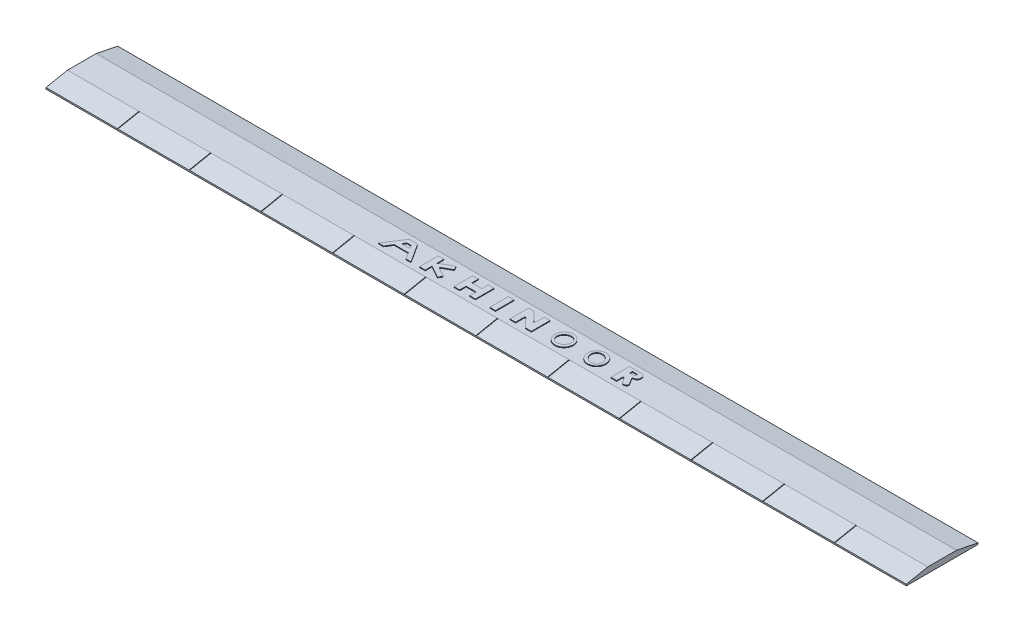
from build123d import *

# Parameters (mm, degrees)
SKETCH1_W           = 304.8
SKETCH1_H           = 25.4
BOSS_EXTRUDE1_DEPTH = 2.032
SKETCH2_OUTSIDE_W   = 88.572
SKETCH2_OUTSIDE_H   = 65.204
CUT_EXTRUDE2_DEPTH  = 306.863252163
SKETCH4_W           = 2.032
SKETCH4_H           = 6.604
SKETCH4_W_2         = 3.556
SKETCH4_H_2         = 2.032
SKETCH4_RX          = 3.302
SKETCH4_RY          = 3.236880332
SKETCH4_RX_2        = 2.468882323
SKETCH4_RY_2        = 2.157115795
BOSS_EXTRUDE2_DEPTH = 0.254
SKETCH5_W           = 0.254
SKETCH5_H           = 7.770905738
CUT_EXTRUDE9_DEPTH  = 0.1778


with BuildPart() as part:
    # Sketch1 → Boss-Extrude1 (new body)
    with BuildSketch(Plane(origin=(0, 0, 0), x_dir=(1, 0, 0), z_dir=(0, 1, 0))):
        with Locations((-152.4, 12.7)):
            Rectangle(SKETCH1_W, SKETCH1_H)
    extrude(amount=BOSS_EXTRUDE1_DEPTH)

    # Sketch2 outside → Cut-Extrude2 (cut, through all)
    with BuildSketch(Plane(origin=(0, 0, 0), x_dir=(0, 0, -1), z_dir=(1, 0, 0))):
        with Locations((12.7, 1.016)):
            Rectangle(SKETCH2_OUTSIDE_W, SKETCH2_OUTSIDE_H)
        Polygon((0, 0.508), (7.62, 2.032), (12.7, 2.032), (17.78, 2.032), (25.4, 0.508), (25.4, 0), (0, 0), align=None, mode=Mode.SUBTRACT)
    extrude(amount=-CUT_EXTRUDE2_DEPTH, mode=Mode.SUBTRACT)

    # Sketch4 → Boss-Extrude2 (add)
    # profile 1 of 11: a face of its own
    with BuildSketch(Plane(origin=(0, 2.032, 0), x_dir=(1, 0, 0), z_dir=(0, 1, 0))):
        with Locations((-180.848, 12.7)):
            Rectangle(SKETCH4_W, SKETCH4_H)
    # profile 2 of 11: a face of its own
    with BuildSketch(Plane(origin=(0, 2.032, 0), x_dir=(1, 0, 0), z_dir=(0, 1, 0))):
        with BuildLine():
            ThreePointArc((-179.701441188, 13.661600321), (-179.796940702, 13.568380332), (-179.832, 13.43961322))
            Line((-179.832, 13.43961322), (-179.832, 12.7))
            Line((-179.832, 12.7), (-179.832, 11.96038678))
            ThreePointArc((-179.832, 11.96038678), (-179.796940702, 11.831619668), (-179.701441188, 11.738399679))
            Line((-179.701441188, 11.738399679), (-175.49264713, 9.398))
            Line((-175.49264713, 9.398), (-174.875441188, 10.507935505))
            ThreePointArc((-174.875441188, 10.507935505), (-174.853173604, 10.701059177), (-174.973987101, 10.853363795))
            Line((-174.973987101, 10.853363795), (-177.895630596, 12.478012899))
            ThreePointArc((-177.895630596, 12.478012899), (-178.026189408, 12.7), (-177.895630596, 12.921987101))
            Line((-177.895630596, 12.921987101), (-174.973987101, 14.546636205))
            ThreePointArc((-174.973987101, 14.546636205), (-174.853173604, 14.698940823), (-174.875441188, 14.892064495))
            Line((-174.875441188, 14.892064495), (-175.49264713, 16.002))
            Line((-175.49264713, 16.002), (-179.701441188, 13.661600321))
        make_face()
    # profile 3 of 11: a face of its own
    with BuildSketch(Plane(origin=(0, 2.032, 0), x_dir=(1, 0, 0), z_dir=(0, 1, 0))):
        Polygon((-167.64, 11.684), (-167.64, 13.716), (-167.64, 16.002), (-169.672, 16.002), (-169.672, 9.398), (-167.64, 9.398), align=None)
    # profile 4 of 11: a face of its own
    with BuildSketch(Plane(origin=(0, 2.032, 0), x_dir=(1, 0, 0), z_dir=(0, 1, 0))):
        with Locations((-163.068, 12.7)):
            Rectangle(SKETCH4_W, SKETCH4_H)
    # profile 5 of 11: a face of its own
    with BuildSketch(Plane(origin=(0, 2.032, 0), x_dir=(1, 0, 0), z_dir=(0, 1, 0))):
        with Locations((-165.862, 12.7)):
            Rectangle(SKETCH4_W_2, SKETCH4_H_2)
    # profile 6 of 11: a face of its own
    with BuildSketch(Plane(origin=(0, 2.032, 0), x_dir=(1, 0, 0), z_dir=(0, 1, 0))):
        with Locations((-155.956, 12.7)):
            Rectangle(SKETCH4_W, SKETCH4_H)
    # profile 7 of 11: a face of its own
    with BuildSketch(Plane(origin=(0, 2.032, 0), x_dir=(1, 0, 0), z_dir=(0, 1, 0))):
        with BuildLine():
            ThreePointArc((-144.710582264, 12.704200751), (-144.432106164, 12.642678456), (-144.272, 12.878686819))
            Line((-144.272, 12.878686819), (-144.272, 16.002))
            Line((-144.272, 16.002), (-142.24, 16.002))
            Line((-142.24, 16.002), (-142.24, 9.398))
            Line((-142.24, 9.398), (-144.272, 9.398))
            ThreePointArc((-144.272, 9.398), (-144.372490146, 9.418723918), (-144.456582264, 9.477513932))
            Line((-144.456582264, 9.477513932), (-147.389417736, 12.58005053))
            ThreePointArc((-147.389417736, 12.58005053), (-147.667893836, 12.641572825), (-147.828, 12.405564462))
            Line((-147.828, 12.405564462), (-147.828, 9.398))
            Line((-147.828, 9.398), (-149.86, 9.398))
            Line((-149.86, 9.398), (-149.86, 16.002))
            Line((-149.86, 16.002), (-147.828, 16.002))
            Line((-147.828, 16.002), (-144.710582264, 12.704200751))
        make_face()
    # profile 8 of 11: a face of its own
    with BuildSketch(Plane(origin=(0, 2.032, 0), x_dir=(1, 0, 0), z_dir=(0, 1, 0))):
        with Locations(Location((-133.923119668, 12.7), (0, 0, -90))):
            Ellipse(SKETCH4_RX, SKETCH4_RY)
        with Locations(Location((-133.923119668, 12.7), (0, 0, 39.538825136))):
            Ellipse(SKETCH4_RX_2, SKETCH4_RY_2, mode=Mode.SUBTRACT)
    # profile 9 of 11: a face of its own
    with BuildSketch(Plane(origin=(0, 2.032, 0), x_dir=(1, 0, 0), z_dir=(0, 1, 0))):
        with Locations(Location((-122.369359004, 12.7), (0, 0, -90))):
            Ellipse(SKETCH4_RX, SKETCH4_RY)
        with Locations(Location((-122.369359004, 12.7), (0, 0, 140.461174864))):
            Ellipse(SKETCH4_RX_2, SKETCH4_RY_2, mode=Mode.SUBTRACT)
    # profile 10 of 11: a face of its own
    with BuildSketch(Plane(origin=(0, 2.032, 0), x_dir=(1, 0, 0), z_dir=(0, 1, 0))):
        with BuildLine():
            Line((-111.560968993, 11.504926098), (-110.164699128, 9.582601219))
            ThreePointArc((-110.164699128, 9.582601219), (-109.140807711, 9.563074793), (-108.572707527, 10.415129425))
            Line((-108.572707527, 10.415129425), (-110.003457223, 12.733919497))
            ThreePointArc((-110.003457223, 12.733919497), (-110.009098265, 12.991067287), (-109.787294363, 13.121297223))
            Line((-109.787294363, 13.121297223), (-109.734478672, 13.121297223))
            ThreePointArc((-109.734478672, 13.121297223), (-108.83645306, 13.493271611), (-108.464478672, 14.391297223))
            Line((-108.464478672, 14.391297223), (-108.464478672, 14.732))
            ThreePointArc((-108.464478672, 14.732), (-108.83645306, 15.630025612), (-109.734478672, 16.002))
            Line((-109.734478672, 16.002), (-111.135692822, 16.002))
            Line((-111.135692822, 16.002), (-114.052478672, 16.002))
            Line((-114.052478672, 16.002), (-114.052478672, 9.398))
            Line((-114.052478672, 9.398), (-112.020478672, 9.398))
            Line((-112.020478672, 9.398), (-112.020478672, 11.355655298))
            ThreePointArc((-112.020478672, 11.355655298), (-111.844953323, 11.597228743), (-111.560968993, 11.504926098))
        make_face()
        with BuildLine():
            Line((-110.242478672, 14.224), (-110.242478672, 14.732))
            ThreePointArc((-110.242478672, 14.732), (-110.31687355, 14.911605122), (-110.496478672, 14.986))
            Line((-110.496478672, 14.986), (-111.766478672, 14.986))
            ThreePointArc((-111.766478672, 14.986), (-111.946083795, 14.911605122), (-112.020478672, 14.732))
            Line((-112.020478672, 14.732), (-112.020478672, 14.224))
            ThreePointArc((-112.020478672, 14.224), (-111.946083795, 14.044394878), (-111.766478672, 13.97))
            Line((-111.766478672, 13.97), (-110.496478672, 13.97))
            ThreePointArc((-110.496478672, 13.97), (-110.31687355, 14.044394878), (-110.242478672, 14.224))
        make_face(mode=Mode.SUBTRACT)
    # profile 11 of 11: a face of its own
    with BuildSketch(Plane(origin=(0, 2.032, 0), x_dir=(1, 0, 0), z_dir=(0, 1, 0))):
        with BuildLine():
            ThreePointArc((-188.050459309, 11.607699185), (-188.142583121, 11.694367018), (-188.265083498, 11.725859361))
            Line((-188.265083498, 11.725859361), (-192.993173567, 11.725859361))
            ThreePointArc((-192.993173567, 11.725859361), (-193.115673944, 11.694367018), (-193.207797756, 11.607699185))
            Line((-193.207797756, 11.607699185), (-194.606359356, 9.398))
            Line((-194.606359356, 9.398), (-196.384359356, 9.398))
            Line((-196.384359356, 9.398), (-192.153128533, 16.002))
            Line((-192.153128533, 16.002), (-190.629128533, 16.002))
            Line((-190.629128533, 16.002), (-189.105128533, 16.002))
            Line((-189.105128533, 16.002), (-184.873897709, 9.398))
            Line((-184.873897709, 9.398), (-186.651897709, 9.398))
            Line((-186.651897709, 9.398), (-188.050459309, 11.607699185))
        make_face()
        with BuildLine():
            ThreePointArc((-189.551175827, 13.249859361), (-189.32866817, 13.381358984), (-189.336551639, 13.639699185))
            Line((-189.336551639, 13.639699185), (-189.792342659, 14.359839824))
            ThreePointArc((-189.792342659, 14.359839824), (-189.88446647, 14.446507657), (-190.006966847, 14.478))
            Line((-190.006966847, 14.478), (-191.251290218, 14.478))
            ThreePointArc((-191.251290218, 14.478), (-191.373790595, 14.446507657), (-191.465914407, 14.359839824))
            Line((-191.465914407, 14.359839824), (-191.921705426, 13.639699185))
            ThreePointArc((-191.921705426, 13.639699185), (-191.929588895, 13.381358984), (-191.707081238, 13.249859361))
            Line((-191.707081238, 13.249859361), (-189.551175827, 13.249859361))
        make_face(mode=Mode.SUBTRACT)
    extrude(amount=BOSS_EXTRUDE2_DEPTH)

    # Sketch5 → Cut-Extrude9 (cut)
    with BuildSketch(Plane(origin=(0, 0.488461538, 0.097692308), x_dir=(1, 0, 0), z_dir=(0, 0.9805806756909202, 0.19611613513818354))):
        with Locations((-127, 3.985079866)):
            Rectangle(SKETCH5_W, SKETCH5_H)
        with Locations((-228.6, 3.985079866)):
            Rectangle(SKETCH5_W, SKETCH5_H)
        with Locations((-203.2, 3.985079866)):
            Rectangle(SKETCH5_W, SKETCH5_H)
        with Locations((-76.2, 3.985079866)):
            Rectangle(SKETCH5_W, SKETCH5_H)
        with Locations((-177.8, 3.985079866)):
            Rectangle(SKETCH5_W, SKETCH5_H)
        with Locations((-50.8, 3.985079866)):
            Rectangle(SKETCH5_W, SKETCH5_H)
        with Locations((-25.4, 3.985079866)):
            Rectangle(SKETCH5_W, SKETCH5_H)
        with Locations((-101.6, 3.985079866)):
            Rectangle(SKETCH5_W, SKETCH5_H)
        with Locations((-152.4, 3.985079866)):
            Rectangle(SKETCH5_W, SKETCH5_H)
        with Locations((-279.4, 3.985079866)):
            Rectangle(SKETCH5_W, SKETCH5_H)
        with Locations((-254, 3.985079866)):
            Rectangle(SKETCH5_W, SKETCH5_H)
    extrude(amount=-CUT_EXTRUDE9_DEPTH, mode=Mode.SUBTRACT)


solid = part.part
